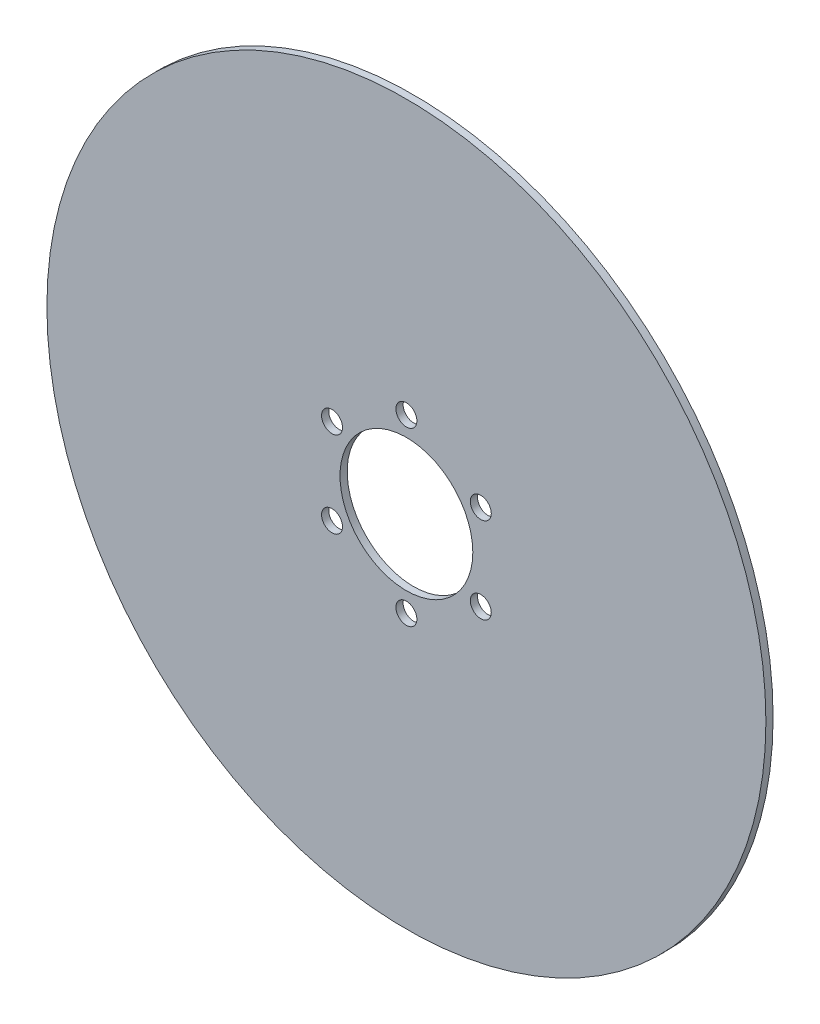
from build123d import *

# Parameters (mm, degrees)
BOSS_EXTRUDE1_DEPTH      = 0.9
BOSS_EXTRUDE1_DEPTH_BACK = 0.9
SKETCH1_R                = 90
SKETCH1_R_2              = 16.625
SKETCH1_R_3              = 2.625


with BuildPart() as part:
    # Sketch1 → Boss-Extrude1 (new, two sides: drawn at the far end of the back side and taken through both)
    with BuildSketch(Plane.XY.offset(-BOSS_EXTRUDE1_DEPTH_BACK)):
        Circle(SKETCH1_R)
        Circle(SKETCH1_R_2, mode=Mode.SUBTRACT)
        with Locations((0, 21.5)):
            Circle(SKETCH1_R_3, mode=Mode.SUBTRACT)
        with Locations((18.619546181, 10.75)):
            Circle(SKETCH1_R_3, mode=Mode.SUBTRACT)
        with Locations((18.619546181, -10.75)):
            Circle(SKETCH1_R_3, mode=Mode.SUBTRACT)
        with Locations((0, -21.5)):
            Circle(SKETCH1_R_3, mode=Mode.SUBTRACT)
        with Locations((-18.619546181, -10.75)):
            Circle(SKETCH1_R_3, mode=Mode.SUBTRACT)
        with Locations((-18.619546181, 10.75)):
            Circle(SKETCH1_R_3, mode=Mode.SUBTRACT)
    extrude(amount=BOSS_EXTRUDE1_DEPTH + BOSS_EXTRUDE1_DEPTH_BACK)


solid = part.part
